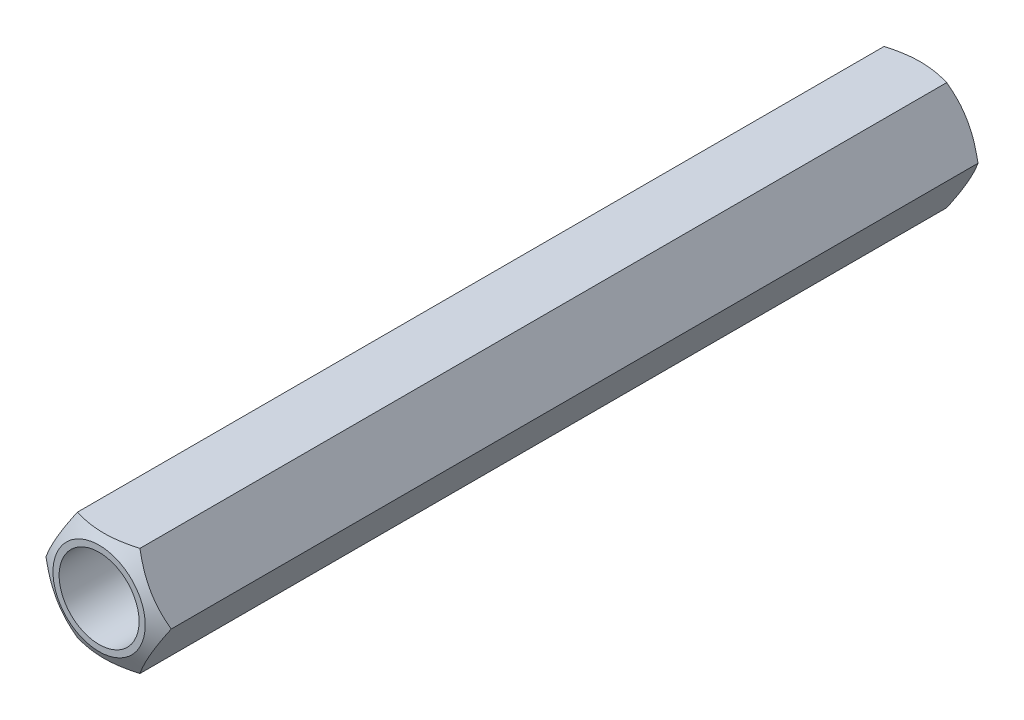
from build123d import *

# Parameters (mm, degrees)
SKETCH_1_R      = 1.5
EXTRUDE_1_DEPTH = 31


with BuildPart() as part:
    # 草图1 → 凸台-拉伸1 (new body)
    with BuildSketch(Plane.XY):
        Polygon((2.35, 0), (1.175, 2.035159699), (-1.175, 2.035159699), (-2.35, 0), (-1.175, -2.035159699), (1.175, -2.035159699), align=None)
        Circle(SKETCH_1_R, mode=Mode.SUBTRACT)
    extrude(amount=EXTRUDE_1_DEPTH)

    # 草图2 → 切除-旋转1 (revolve, cut)
    with BuildSketch(Plane(origin=(0, 0, 0), x_dir=(1, 0, 0), z_dir=(0, 1, 0))):
        Polygon((0, 1), (2.35, -0.356773133), (2.35, 2.686947128), (0, 2.686947128), align=None)
    cut_revolve_1 = revolve(axis=Axis((0, 0, 0), (0, 0, -1)), mode=Mode.SUBTRACT)

    # 镜向1: 切除-旋转1 across plane
    add(cut_revolve_1.mirror(Plane(origin=(0, 0, 15.5), x_dir=(1, 0, 0), z_dir=(0, 0, -1))), mode=Mode.SUBTRACT)


solid = part.part
